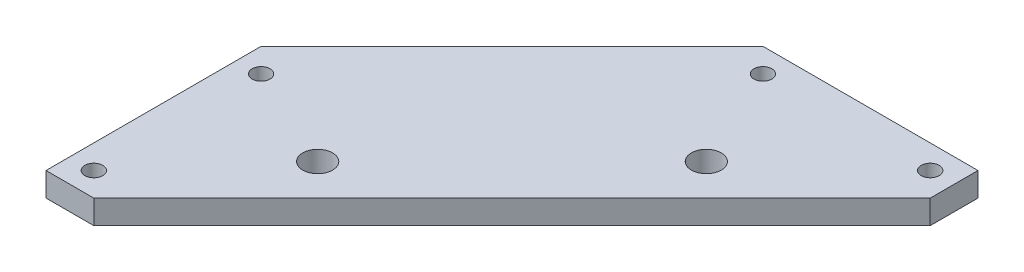
from build123d import *

# Parameters (mm, degrees)
SKETCH_1_R      = 1.5
SKETCH_1_R_2    = 2.5
EXTRUDE_1_DEPTH = 4


with BuildPart() as part:
    # 草图1 → 凸台-拉伸1 (new body)
    with BuildSketch(Plane(origin=(0, 0, 0), x_dir=(1, 0, 0), z_dir=(0, 1, 0))):
        Polygon((-21, -21), (21, 21), (57, 21), (57, 13), (-13, -57), (-21, -57), align=None)
        with Locations((53, 17)):
            Circle(SKETCH_1_R, mode=Mode.SUBTRACT)
        with Locations((25, 17)):
            Circle(SKETCH_1_R, mode=Mode.SUBTRACT)
        with Locations((-17, -53)):
            Circle(SKETCH_1_R, mode=Mode.SUBTRACT)
        with Locations((-17, -25)):
            Circle(SKETCH_1_R, mode=Mode.SUBTRACT)
        with Locations((32.960155108, -0.433243174)):
            Circle(SKETCH_1_R_2, mode=Mode.SUBTRACT)
        with Locations((0.433243174, -32.960155108)):
            Circle(SKETCH_1_R_2, mode=Mode.SUBTRACT)
    extrude(amount=EXTRUDE_1_DEPTH)


solid = part.part
